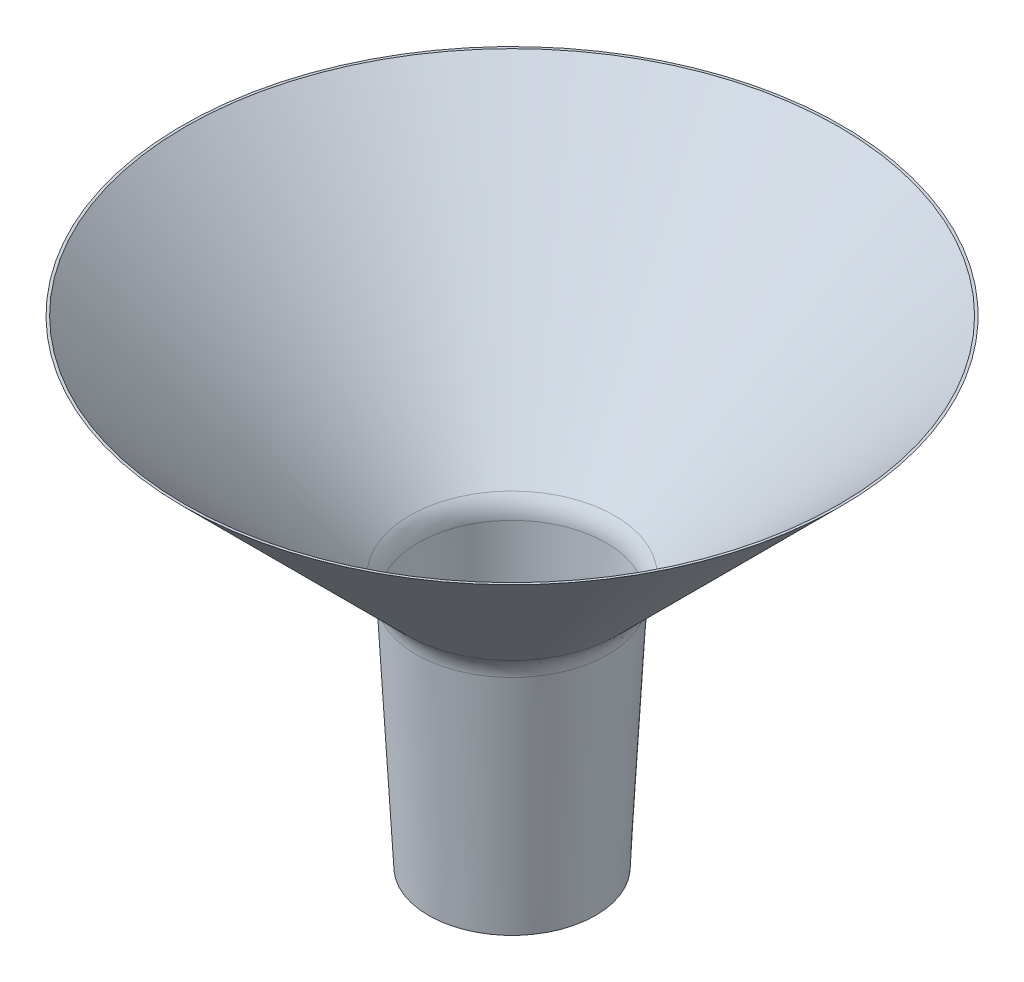
from build123d import *

# Parameters (mm, degrees)
FILLET1_R = 10
FILLET2_R = 9


with BuildPart() as part:
    # Sketch1 → Revolve1 (revolve)
    with BuildSketch(Plane.XY, mode=Mode.PRIVATE) as revolve1_sk:
        Polygon((25, 0), (28.930583446, 75), (100, 146.069416554), (100.777817459, 146.069416554), (29.46878025, 74.760379345), (25.55075479, 0), align=None)
    revolve(revolve1_sk.sketch.rotate(Axis((0, -2.9, 0), (0, 1, 0)), 270), axis=Axis((0, -2.9, 0), (0, 1, 0)))

    # Fillet1
    fillet1_edges = [part.edges().sort_by_distance(p)[0] for p in [
        (0, 74.760379345, -29.46878025),
    ]]
    fillet(fillet1_edges, radius=FILLET1_R)

    # Fillet2
    fillet2_edges = [part.edges().sort_by_distance(p)[0] for p in [
        (0, 75, -28.930583446),
    ]]
    fillet(fillet2_edges, radius=FILLET2_R)


solid = part.part
